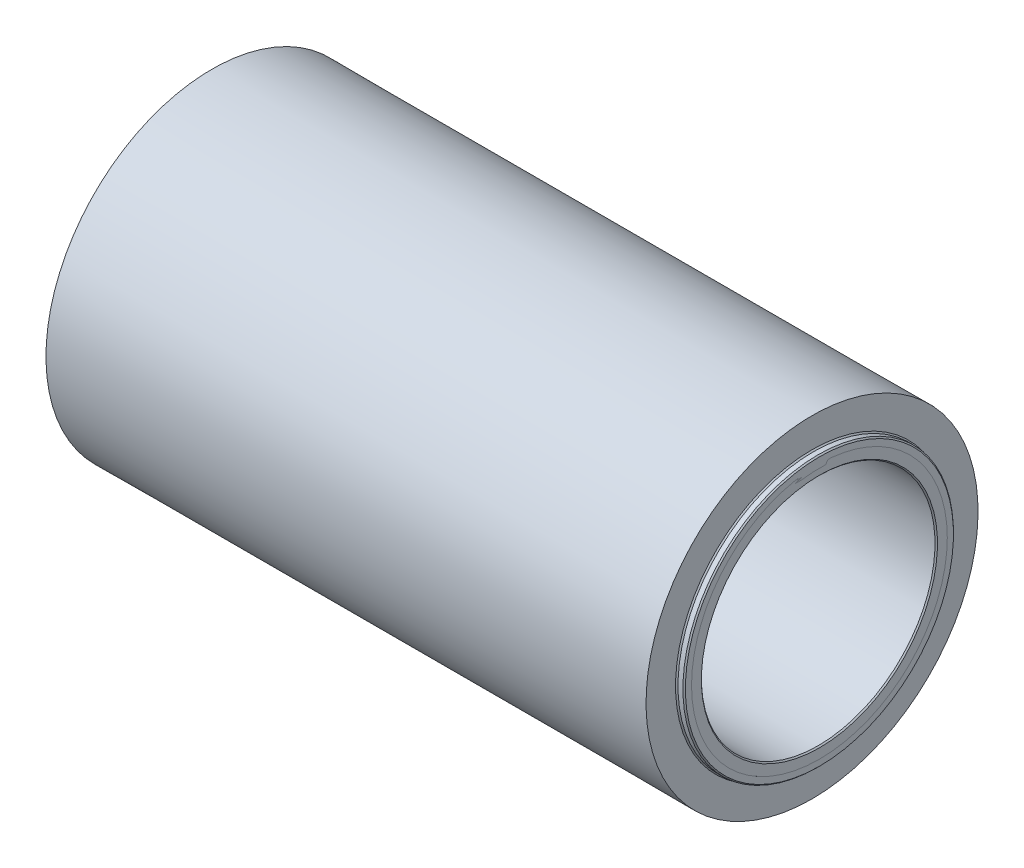
from build123d import *


with BuildPart() as part:
    # Эскиз3 → Повернуть2 (revolve)
    with BuildSketch(Plane.XY):
        Polygon((25.2, 10.4), (25.1, 10.5), (4.9, 10.5), (4.8, 10.4), (4.8, 10), (3.5, 10), (3.5, 10.4), (3.4, 10.5), (0.1, 10.5), (0, 10.4), (0, 9.5), (49.9, 9.5), (50, 9.6), (50, 10.4), (49.9, 10.5), (46.6, 10.5), (46.5, 10.4), (46.5, 10), (25.2, 10), align=None)
    revolve(axis=Axis((0, 0, 0), (1, 0, 0)))


with BuildPart() as body_2:
    # Эскиз7 → Повернуть3 (revolve)
    with BuildSketch(Plane.XY, mode=Mode.PRIVATE) as revolve_3_sk:
        Polygon((0, 10.1), (0, 10.9), (0.1, 11), (0.5, 11), (0.6, 11.1), (0.6, 13.5), (49.4, 13.5), (49.4, 11.1), (49.5, 11), (49.9, 11), (50, 10.9), (50, 10.1), (49.9, 10), (0.1, 10), align=None)
    revolve(revolve_3_sk.sketch.rotate(Axis((50.760752351, 0, 0), (-0.9999999999514948, 9.849390109362252e-06, 0)), 180), axis=Axis((50.760752351, 0, 0), (-0.9999999999514948, 9.849390109362252e-06, 0)))


solid = Compound([part.part, body_2.part])
